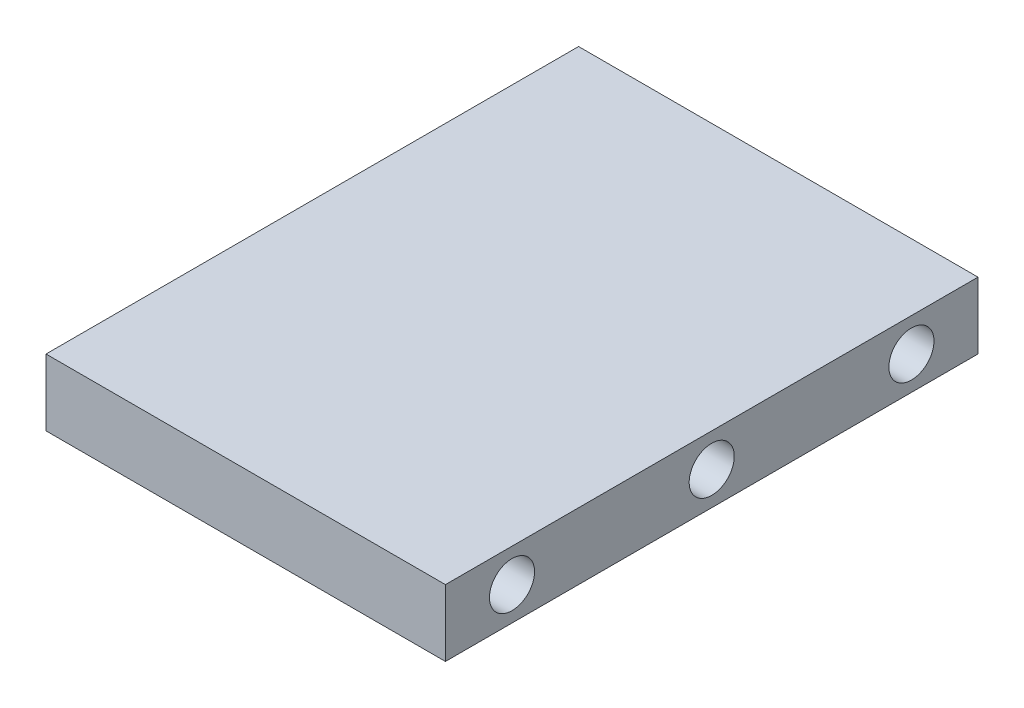
from build123d import *

# Parameters (mm, degrees)
SKETCH1_W           = 38.1
SKETCH1_H           = 50.8
BOSS_EXTRUDE1_DEPTH = 6.35
SKETCH2_R           = 2.15265
CUT_EXTRUDE1_DEPTH  = 25.4


with BuildPart() as part:
    # Sketch1 → Boss-Extrude1 (new body)
    with BuildSketch(Plane(origin=(0, 0, 0), x_dir=(1, 0, 0), z_dir=(0, 1, 0))):
        Rectangle(SKETCH1_W, SKETCH1_H)
    extrude(amount=BOSS_EXTRUDE1_DEPTH)

    # Sketch2 → Cut-Extrude1 (cut)
    with BuildSketch(Plane.ZY.offset(19.05)):
        with Locations((-19.05, 3.175)):
            Circle(SKETCH2_R)
        with Locations((0, 3.175)):
            Circle(SKETCH2_R)
        with Locations((19.05, 3.175)):
            Circle(SKETCH2_R)
    cut_extrude1 = extrude(amount=-CUT_EXTRUDE1_DEPTH, mode=Mode.SUBTRACT)

    # Mirror1: Cut-Extrude1 across plane
    add(cut_extrude1.mirror(Plane(origin=(0, 0, 0), x_dir=(0, 0, 1), z_dir=(1, 0, 0))), mode=Mode.SUBTRACT)


solid = part.part
